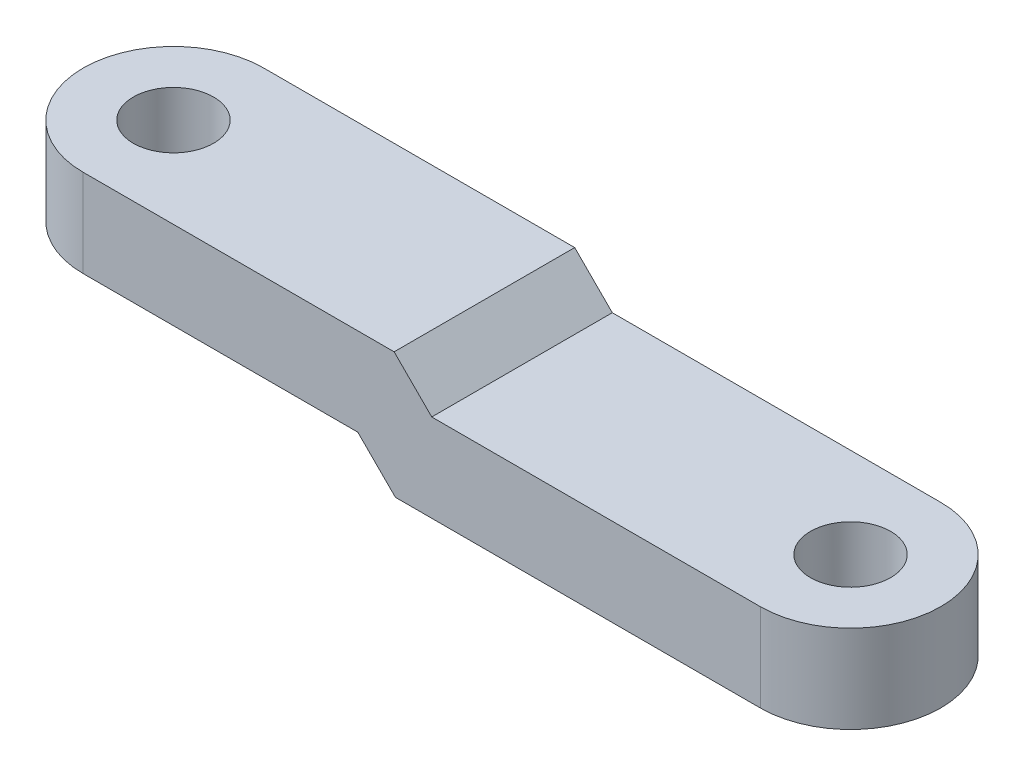
from build123d import *

# Parameters (mm, degrees)
SKETCH1_R           = 1.6
BOSS_EXTRUDE1_DEPTH = 5
SKETCH2_W           = 3.6
SKETCH2_H           = 1.5
CUT_EXTRUDE1_DEPTH  = 32.830802692


with BuildPart() as part:
    # Sketch1 → Boss-Extrude1 (new body)
    with BuildSketch(Plane(origin=(0, 0, 0), x_dir=(1, 0, 0), z_dir=(0, 1, 0))):
        with BuildLine():
            Line((-27, 3.6), (0, 3.6))
            ThreePointArc((0, 3.6), (3.6, 0), (0, -3.6))
            Line((0, -3.6), (-27, -3.6))
            ThreePointArc((-27, -3.6), (-30.6, 0), (-27, 3.6))
        make_face()
        with Locations(Location((0, 0, 0), (0, 0, 270))):
            Circle(SKETCH1_R, mode=Mode.SUBTRACT)
        with Locations(Location((-27, 0, 0), (0, 0, 270))):
            Circle(SKETCH1_R, mode=Mode.SUBTRACT)
    extrude(amount=BOSS_EXTRUDE1_DEPTH)

    # Sketch2 → Cut-Extrude1 (cut, through all)
    with BuildSketch(Plane.XY.offset(3.6)):
        Polygon((-16.049747468, 1.5), (-27, 1.5), (-27, 0), (-14.549747468, 0), align=None)
        with Locations((-28.8, 0.75)):
            Rectangle(SKETCH2_W, SKETCH2_H)
        Polygon((0, 5), (-14.6, 5), (-13.1, 3.5), (0, 3.5), align=None)
        with Locations((1.8, 4.25)):
            Rectangle(SKETCH2_W, SKETCH2_H)
    extrude(amount=-CUT_EXTRUDE1_DEPTH, mode=Mode.SUBTRACT)


solid = part.part
